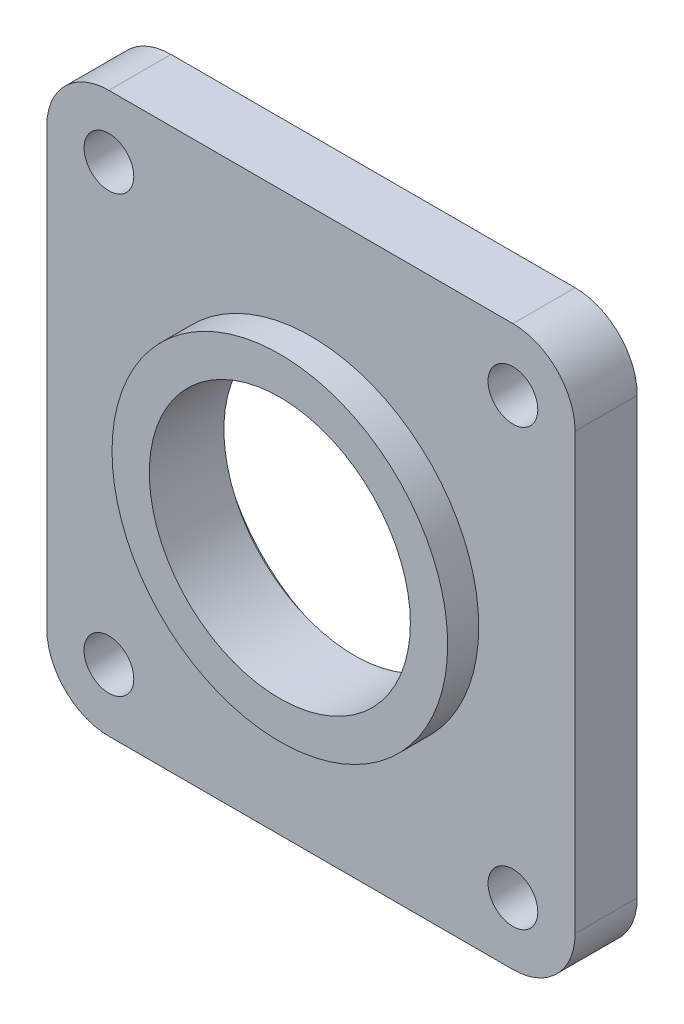
from build123d import *

# Parameters (mm, degrees)
SZKIC1_W                                             = 85
SZKIC1_H                                             = 90
DODANIE_WYCI_GNI_CIE1_DEPTH                          = 10
DODANIE_WYCI_GNI_CIE2_START                          = 5
SZKIC9_R                                             = 27
SZKIC9_R_2                                           = 21
DODANIE_WYCI_GNI_CIE2_DEPTH                          = 5
ZAOKR_GLENIE1_R                                      = 10
POG_BIENIE_STO_KOWE_POD_M6_WKR_T_USTALAJ_D           = 6.4
POG_BIENIE_STO_KOWE_POD_M6_WKR_T_USTALAJ_DEPTH       = 26
POG_BIENIE_STO_KOWE_POD_M6_WKR_T_USTALAJ_CSINK_D     = 13.44
POG_BIENIE_STO_KOWE_POD_M6_WKR_T_USTALAJ_CSINK_ANGLE = 90
POG_BIENIE_STO_KOWE_POD_M6_WKR_T_USTALAJ_TIP         = 1.922753981
SZKIC12_R                                            = 4
WYTNIJ_WYCI_GNI_CIE2_DEPTH                           = 64.688696014


with BuildPart() as part:
    # Szkic1 → Dodanie-wyciągnięcie1 (new body)
    with BuildSketch(Plane.XY):
        Rectangle(SZKIC1_W, SZKIC1_H)
    extrude(amount=DODANIE_WYCI_GNI_CIE1_DEPTH)

    # Szkic2 → Wycięcie-obrót1 (revolve, cut)
    with BuildSketch(Plane(origin=(0, 0, 0), x_dir=(1, 0, 0), z_dir=(0, 1, 0))):
        Polygon((0, 0), (25, 0), (25, -3), (21, -3), (21, -10), (0, -10), align=None)
    revolve(axis=Axis((0, 0, 0), (0, 0, -1)), mode=Mode.SUBTRACT)

    # Szkic9 → Dodanie-wyciągnięcie2 (add)
    with BuildSketch(Plane.XY.offset(10).offset(DODANIE_WYCI_GNI_CIE2_START)):
        Circle(SZKIC9_R)
        Circle(SZKIC9_R_2, mode=Mode.SUBTRACT)
    extrude(amount=-DODANIE_WYCI_GNI_CIE2_DEPTH)

    # Zaokrąglenie1
    zaokr_glenie1_edges = [part.edges().sort_by_distance(p)[0] for p in [
        (42.5, -45, 5),
        (-42.5, -45, 5),
        (-42.5, 45, 5),
        (42.5, 45, 5),
    ]]
    fillet(zaokr_glenie1_edges, radius=ZAOKR_GLENIE1_R)

    # Pogłębienie stożkowe pod M6 Wkręt ustalający1
    with Locations(Plane(origin=(267.5, 155, -16), x_dir=(1, 0, 0), z_dir=(0, 0, -1))):
        with Locations((-235, 190), (-235, 120), (-300, 120), (-300, 190)):
            CounterSinkHole(POG_BIENIE_STO_KOWE_POD_M6_WKR_T_USTALAJ_D / 2, POG_BIENIE_STO_KOWE_POD_M6_WKR_T_USTALAJ_CSINK_D / 2, depth=POG_BIENIE_STO_KOWE_POD_M6_WKR_T_USTALAJ_DEPTH, counter_sink_angle=POG_BIENIE_STO_KOWE_POD_M6_WKR_T_USTALAJ_CSINK_ANGLE)
            with Locations((0, 0, -(POG_BIENIE_STO_KOWE_POD_M6_WKR_T_USTALAJ_DEPTH + POG_BIENIE_STO_KOWE_POD_M6_WKR_T_USTALAJ_TIP / 2))):  # 118° drill point
                Cone(0, POG_BIENIE_STO_KOWE_POD_M6_WKR_T_USTALAJ_D / 2, POG_BIENIE_STO_KOWE_POD_M6_WKR_T_USTALAJ_TIP, mode=Mode.SUBTRACT)

    # Szkic12 → Wytnij-wyciągnięcie2 (cut, through all)
    with BuildSketch(Plane(origin=(0, 0, 0), x_dir=(-1, 0, 0), z_dir=(0, 0, -1))):
        with Locations((-32.5, 35)):
            Circle(SZKIC12_R)
        with Locations((32.5, 35)):
            Circle(SZKIC12_R)
        with Locations((32.5, -35)):
            Circle(SZKIC12_R)
        with Locations((-32.5, -35)):
            Circle(SZKIC12_R)
    extrude(amount=-WYTNIJ_WYCI_GNI_CIE2_DEPTH, mode=Mode.SUBTRACT)


solid = part.part
